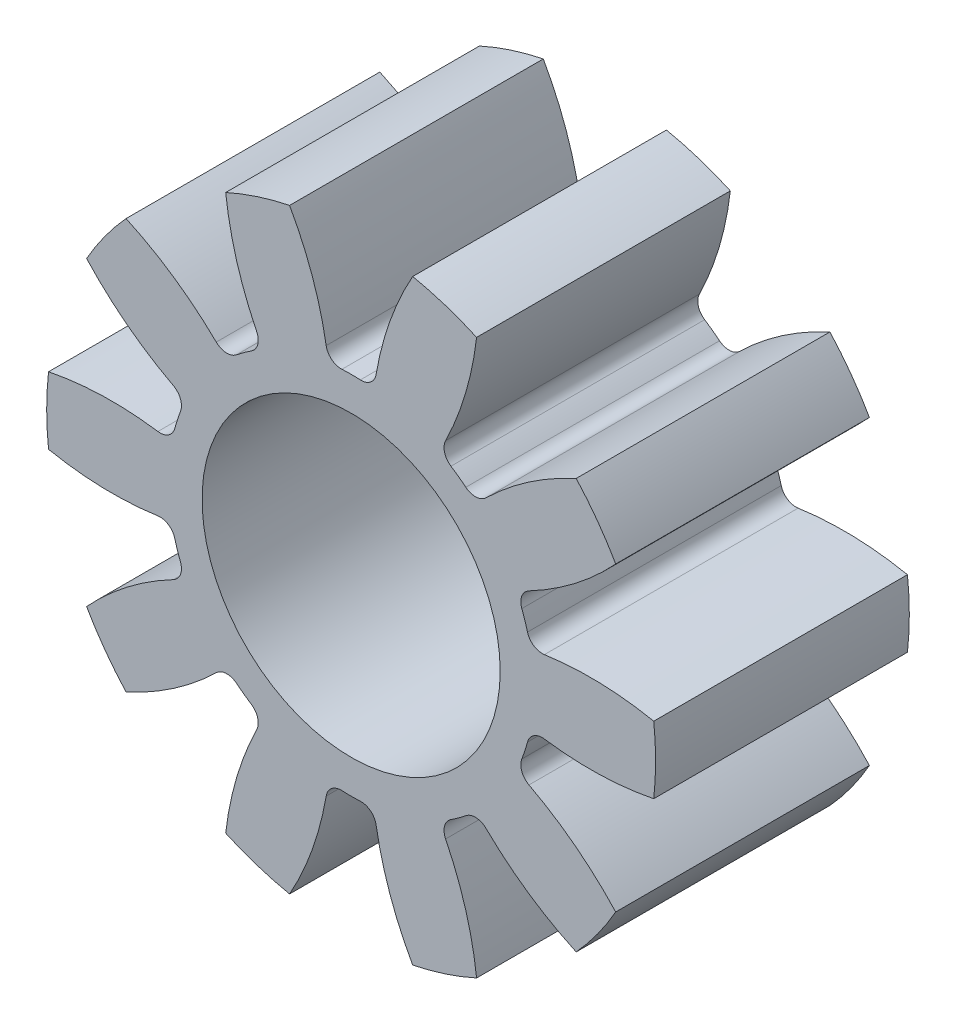
from build123d import *

# Parameters (mm, degrees)
SKETCH1_R                = 4.8
BOSS_EXTRUDE1_DEPTH      = 2
CUT_EXTRUDE9_DEPTH       = 2
FILLET1_R                = 0.24
CIRPATTERN1_COUNT        = 10
FILLET1_OF_CIRPATTERN1_R = 0.24
SKETCH12_R               = 2.35
CUT_EXTRUDE8_DEPTH       = 5


with BuildPart() as part:
    # Sketch1 → Boss-Extrude1 (new, symmetric)
    with BuildSketch(Plane.XY):
        Circle(SKETCH1_R)
    extrude(amount=BOSS_EXTRUDE1_DEPTH, both=True)

    # Sketch13 → Cut-Extrude9 (cut, symmetric)
    with BuildSketch(Plane.XY):
        with BuildLine():
            ThreePointArc((0.361155639, 2.857265582), (0, 2.88), (-0.361155639, 2.857265582))
            ThreePointArc((-0.361155639, 2.857265582), (-0.576396337, 3.808634259), (-0.970590274, 4.700846149))
            ThreePointArc((-0.970590274, 4.700846149), (0, 4.8), (0.970590274, 4.700846149))
            ThreePointArc((0.970590274, 4.700846149), (0.576396337, 3.808634259), (0.361155639, 2.857265582))
        make_face()
    cut_extrude9 = extrude(amount=CUT_EXTRUDE9_DEPTH, both=True, mode=Mode.SUBTRACT)

    # Fillet1
    fillet1_edges = [part.edges().sort_by_distance(p)[0] for p in [
        (0.361155639, 2.857265582, 0),
        (-0.361155639, 2.857265582, 0),
    ]]
    fillet(fillet1_edges, radius=FILLET1_R)

    # CirPattern1: Cut-Extrude9 ×10 about axis
    cirpattern1_axis = Axis((0, 0, 0), (0, 0, 1))
    for i in range(1, CIRPATTERN1_COUNT):
        add(cut_extrude9.rotate(cirpattern1_axis, i * 360 / CIRPATTERN1_COUNT), mode=Mode.SUBTRACT)

    # Fillet1 of CirPattern1
    fillet1_of_cirpattern1_edges = [part.edges().sort_by_distance(p)[0] for p in [
        (-1.387277521, 2.523858372, 0),
        (-1.971639621, 2.099294454, 0),
        (-2.60581782, 1.226423046, 0),
        (-2.82902428, 0.539464198, 0),
        (-2.82902428, -0.539464198, 0),
        (-2.60581782, -1.226423046, 0),
        (-1.971639621, -2.099294454, 0),
        (-1.387277521, -2.523858372, 0),
        (-0.361155639, -2.857265582, 0),
        (0.361155639, -2.857265582, 0),
        (1.387277521, -2.523858372, 0),
        (1.971639621, -2.099294454, 0),
        (2.60581782, -1.226423046, 0),
        (2.82902428, -0.539464198, 0),
        (2.82902428, 0.539464198, 0),
        (2.60581782, 1.226423046, 0),
        (1.971639621, 2.099294454, 0),
        (1.387277521, 2.523858372, 0),
    ]]
    fillet(fillet1_of_cirpattern1_edges, radius=FILLET1_OF_CIRPATTERN1_R)

    # Sketch12 → Cut-Extrude8 (cut, symmetric)
    with BuildSketch(Plane.XY):
        Circle(SKETCH12_R)
    extrude(amount=CUT_EXTRUDE8_DEPTH, both=True, mode=Mode.SUBTRACT)


solid = part.part
